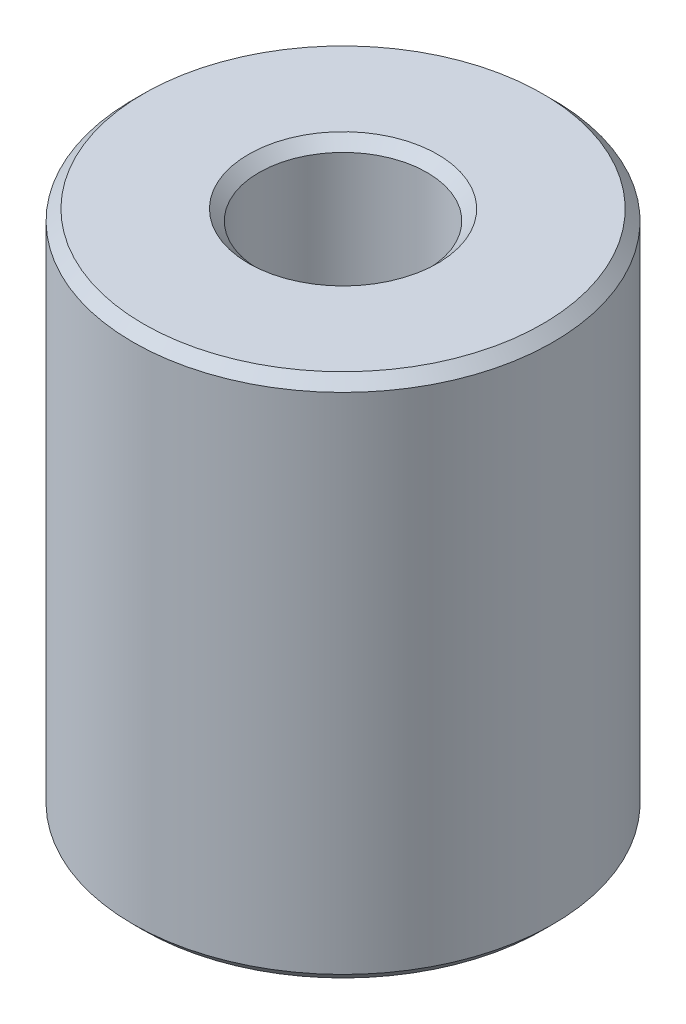
from build123d import *

# Parameters (mm, degrees)
SKETCH1_R           = 10
BOSS_EXTRUDE1_DEPTH = 25
SKETCH2_R           = 4
CUT_EXTRUDE1_DEPTH  = 10
SKETCH3_R           = 2.5
CUT_EXTRUDE2_DEPTH  = 10
CHAMFER1_SIZE       = 0.5


with BuildPart() as part:
    # Sketch1 → Boss-Extrude1 (new body)
    with BuildSketch(Plane(origin=(0, 0, 0), x_dir=(1, 0, 0), z_dir=(0, 1, 0))):
        with Locations(Location((0, 0, 0), (0, 0, 270))):
            Circle(SKETCH1_R)
    extrude(amount=BOSS_EXTRUDE1_DEPTH)

    # Sketch2 → Cut-Extrude1 (cut)
    with BuildSketch(Plane(origin=(0, 25, 0), x_dir=(1, 0, 0), z_dir=(0, 1, 0))):
        with Locations(Location((0, 0, 0), (0, 0, 270))):
            Circle(SKETCH2_R)
    extrude(amount=-CUT_EXTRUDE1_DEPTH, mode=Mode.SUBTRACT)

    # Sketch3 → Cut-Extrude2 (cut)
    with BuildSketch(Plane.XZ):
        with Locations(Location((0, 0, 0), (0, 0, 270))):
            Circle(SKETCH3_R)
    extrude(amount=-CUT_EXTRUDE2_DEPTH, mode=Mode.SUBTRACT)

    # Chamfer1
    chamfer1_edges = [part.edges().sort_by_distance(p)[0] for p in [
        (0, 0, 2.5),
        (0, 0, -10),
        (0, 25, -10),
        (0, 25, -4),
    ]]
    chamfer(chamfer1_edges, length=CHAMFER1_SIZE)


solid = part.part
